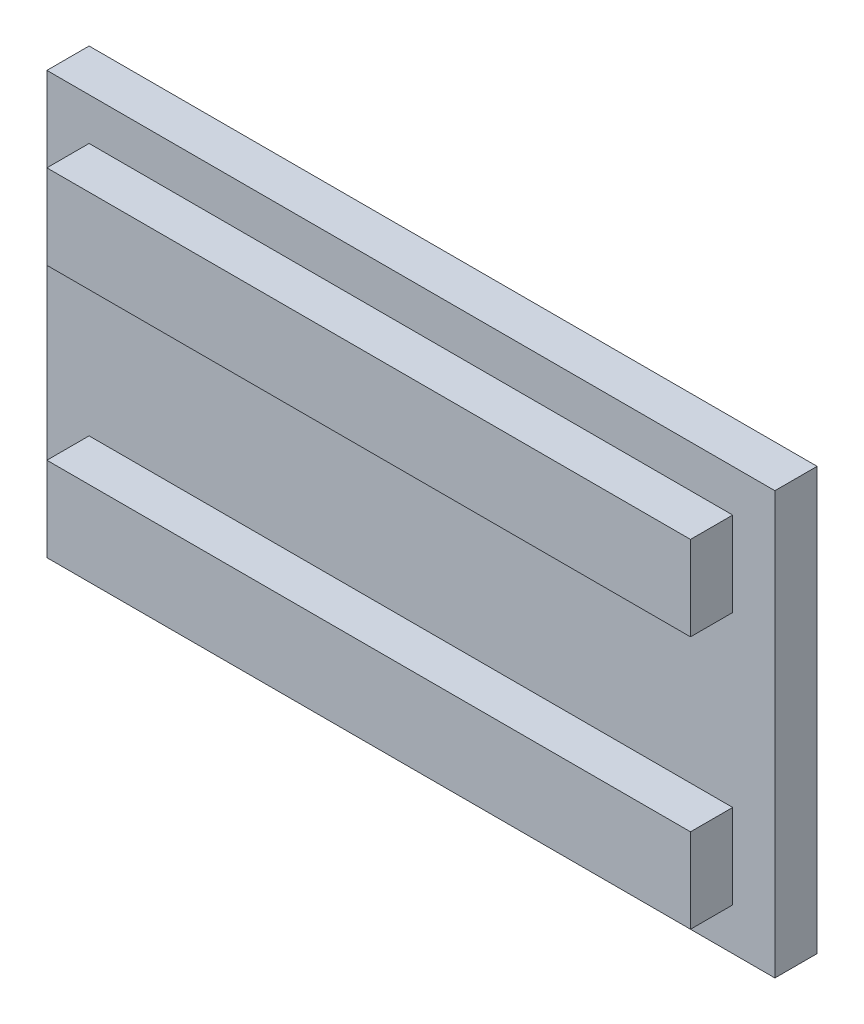
from build123d import *

# Parameters (mm, degrees)
SKETCH1_W           = 34.5
SKETCH1_H           = 20
BOSS_EXTRUDE1_DEPTH = 2
SKETCH2_W           = 30.5
SKETCH2_H           = 4
BOSS_EXTRUDE2_DEPTH = 2


with BuildPart() as part:
    # Sketch1 → Boss-Extrude1 (new body)
    with BuildSketch(Plane.XY):
        Rectangle(SKETCH1_W, SKETCH1_H)
    extrude(amount=BOSS_EXTRUDE1_DEPTH)

    # Sketch2 → Boss-Extrude2 (add)
    with BuildSketch(Plane.XY.offset(2)):
        with Locations((0, 6)):
            Rectangle(SKETCH2_W, SKETCH2_H)
        with Locations((0, -6)):
            Rectangle(SKETCH2_W, SKETCH2_H)
    extrude(amount=BOSS_EXTRUDE2_DEPTH)


solid = part.part
